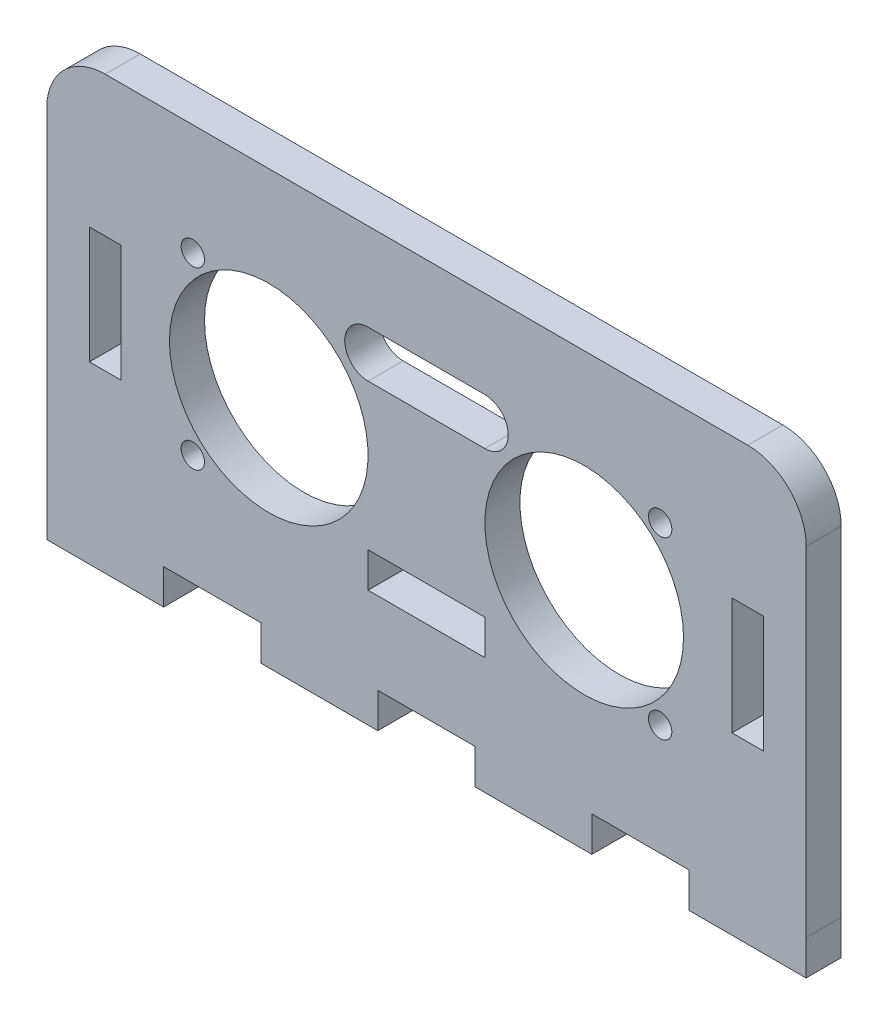
from build123d import *

# Parameters (mm, degrees)
SKETCH1_R           = 1
SKETCH1_R_2         = 8.5
SKETCH1_W           = 10
SKETCH1_H           = 3
SKETCH1_W_2         = 2.7
SKETCH1_H_2         = 10
BOSS_EXTRUDE1_DEPTH = 3
FILLET1_R           = 5


with BuildPart() as part:
    # Sketch1 → Boss-Extrude1 (new body)
    with BuildSketch(Plane.XY):
        Polygon((-18.34, -7), (-26.67, -7), (-26.67, -10), (-36.67, -10), (-36.67, -7), (-45, -7), (-45, -10), (-55, -10), (-55, -7), (-55, 27), (10, 27), (10, -7), (9.99, -7), (9.99, -10), (-0.01, -10), (-0.01, -7), (-8.34, -7), (-8.34, -10), (-18.34, -10), align=None)
        with Locations((-42.5, 17.5)):
            Circle(SKETCH1_R, mode=Mode.SUBTRACT)
        with Locations((-9, 10)):
            Circle(SKETCH1_R_2, mode=Mode.SUBTRACT)
        with Locations(Location((-36, 10, 0), (0, 0, 180))):
            Circle(SKETCH1_R_2, mode=Mode.SUBTRACT)
        with Locations(Location((-2.5, 17.5, 0), (0, 0, 180))):
            Circle(SKETCH1_R, mode=Mode.SUBTRACT)
        with Locations((-2.5, 2.5)):
            Circle(SKETCH1_R, mode=Mode.SUBTRACT)
        with Locations(Location((-42.5, 2.5, 0), (0, 0, 180))):
            Circle(SKETCH1_R, mode=Mode.SUBTRACT)
        with BuildLine():
            Line((-27.5, 19.5), (-17.5, 19.5))
            ThreePointArc((-17.5, 19.5), (-15.5, 17.5), (-17.5, 15.5))
            Line((-17.5, 15.5), (-27.5, 15.5))
            ThreePointArc((-27.5, 15.5), (-29.5, 17.5), (-27.5, 19.5))
        make_face(mode=Mode.SUBTRACT)
        with Locations((-22.5, 1.5)):
            Rectangle(SKETCH1_W, SKETCH1_H, mode=Mode.SUBTRACT)
        with Locations((-50, 10)):
            Rectangle(SKETCH1_W_2, SKETCH1_H_2, mode=Mode.SUBTRACT)
        with Locations((5, 10)):
            Rectangle(SKETCH1_W_2, SKETCH1_H_2, mode=Mode.SUBTRACT)
    extrude(amount=BOSS_EXTRUDE1_DEPTH)

    # Fillet1
    fillet1_edges = [part.edges().sort_by_distance(p)[0] for p in [
        (-55, 27, 1.5),
        (10, 27, 1.5),
    ]]
    fillet(fillet1_edges, radius=FILLET1_R)


solid = part.part
